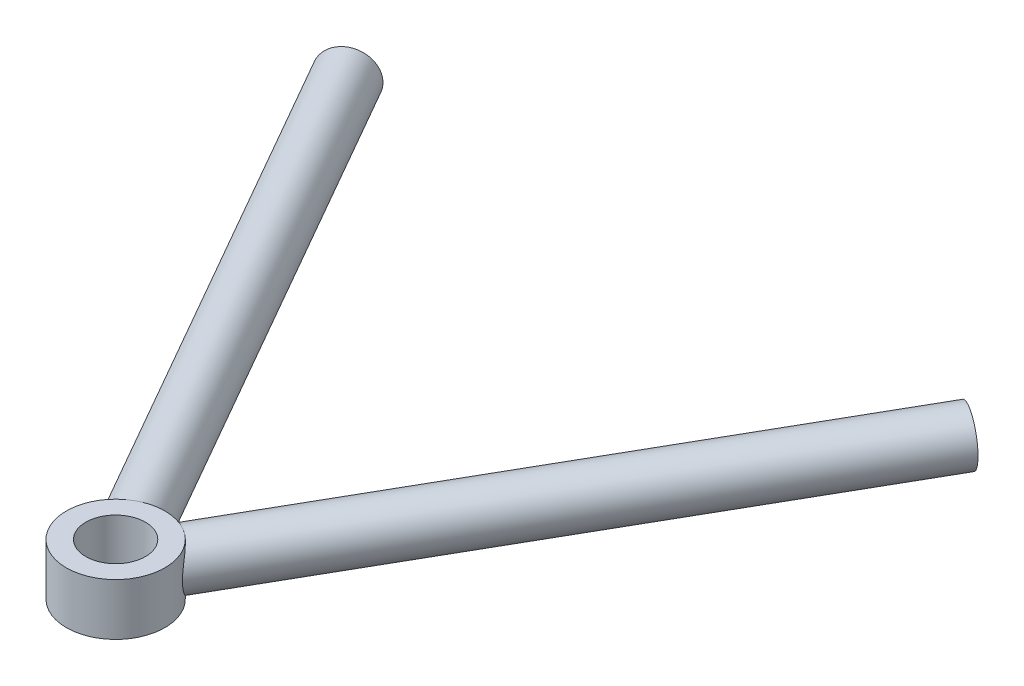
from build123d import *

# Parameters (mm, degrees)
SKETCH1_R                = 19.0062
SKETCH1_R_2              = 11.5062
BOSS_EXTRUDE1_DEPTH      = 10
BOSS_EXTRUDE2_REACH      = 269.283
BOSS_EXTRUDE2_END_RADIUS = 19.0062
SKETCH5_R                = 10
SKETCH5_R_2              = 7
BOSS_EXTRUDE3_REACH      = 339.305
BOSS_EXTRUDE3_END_RADIUS = 19.0062
SKETCH6_R                = 10
SKETCH6_R_2              = 7


with BuildPart() as part:
    # Sketch1 → Boss-Extrude1 (new, symmetric)
    with BuildSketch(Plane(origin=(0, 0, 0), x_dir=(1, 0, 0), z_dir=(0, 1, 0))):
        with Locations(Location((0, 0, 0), (0, 0, 270))):
            Circle(SKETCH1_R)
        with Locations(Location((0, 0, 0), (0, 0, 270))):
            Circle(SKETCH1_R_2, mode=Mode.SUBTRACT)
    extrude(amount=BOSS_EXTRUDE1_DEPTH, both=True)

    # Boss-Extrude2: up to this cylinder (the profile starts outside it)
    boss_extrude2_end = Plane(origin=(0, 0, 0), z_dir=(0, -1, 0)) * Cylinder(BOSS_EXTRUDE2_END_RADIUS, 577.5784, mode=Mode.PRIVATE)
    # Sketch5 → Boss-Extrude2 (add, up to the surface)
    with BuildSketch(Plane(origin=(119.743088876, 0, -209.223041267), x_dir=(0.8679086712012518, 0, 0.4967238049999995), z_dir=(0.4967238049999996, 0, -0.8679086712012518)), mode=Mode.PRIVATE) as boss_extrude2_sk1:
        with Locations(Location((0, 0, 0), (0, 0, 180))):
            Circle(SKETCH5_R)
        with Locations(Location((0, 0, 0), (0, 0, 180))):
            Circle(SKETCH5_R_2, mode=Mode.SUBTRACT)
    boss_extrude2_tool1 = extrude(boss_extrude2_sk1.sketch, amount=-BOSS_EXTRUDE2_REACH, mode=Mode.PRIVATE) - boss_extrude2_end
    add(boss_extrude2_tool1.solids().sort_by_distance((128.176694, 0, -204.396298))[0])

    # Boss-Extrude3: up to this cylinder (the profile starts outside it)
    boss_extrude3_end = Plane(origin=(0, 0, 0), z_dir=(0, -1, 0)) * Cylinder(BOSS_EXTRUDE3_END_RADIUS, 717.6224, mode=Mode.PRIVATE)
    # Sketch6 → Boss-Extrude3 (add, up to the surface)
    with BuildSketch(Plane(origin=(-119.743088876, 0, -209.223041267), x_dir=(-0.8679086712012486, 0, 0.4967238050000052), z_dir=(-0.4967238050000052, 0, -0.8679086712012486)), mode=Mode.PRIVATE) as boss_extrude3_sk1:
        Circle(SKETCH6_R)
        Circle(SKETCH6_R_2, mode=Mode.SUBTRACT)
    boss_extrude3_tool1 = extrude(boss_extrude3_sk1.sketch, amount=-BOSS_EXTRUDE3_REACH, mode=Mode.PRIVATE) - boss_extrude3_end
    add(boss_extrude3_tool1.solids().sort_by_distance((-111.309484, 0, -214.049785))[0])


solid = part.part
